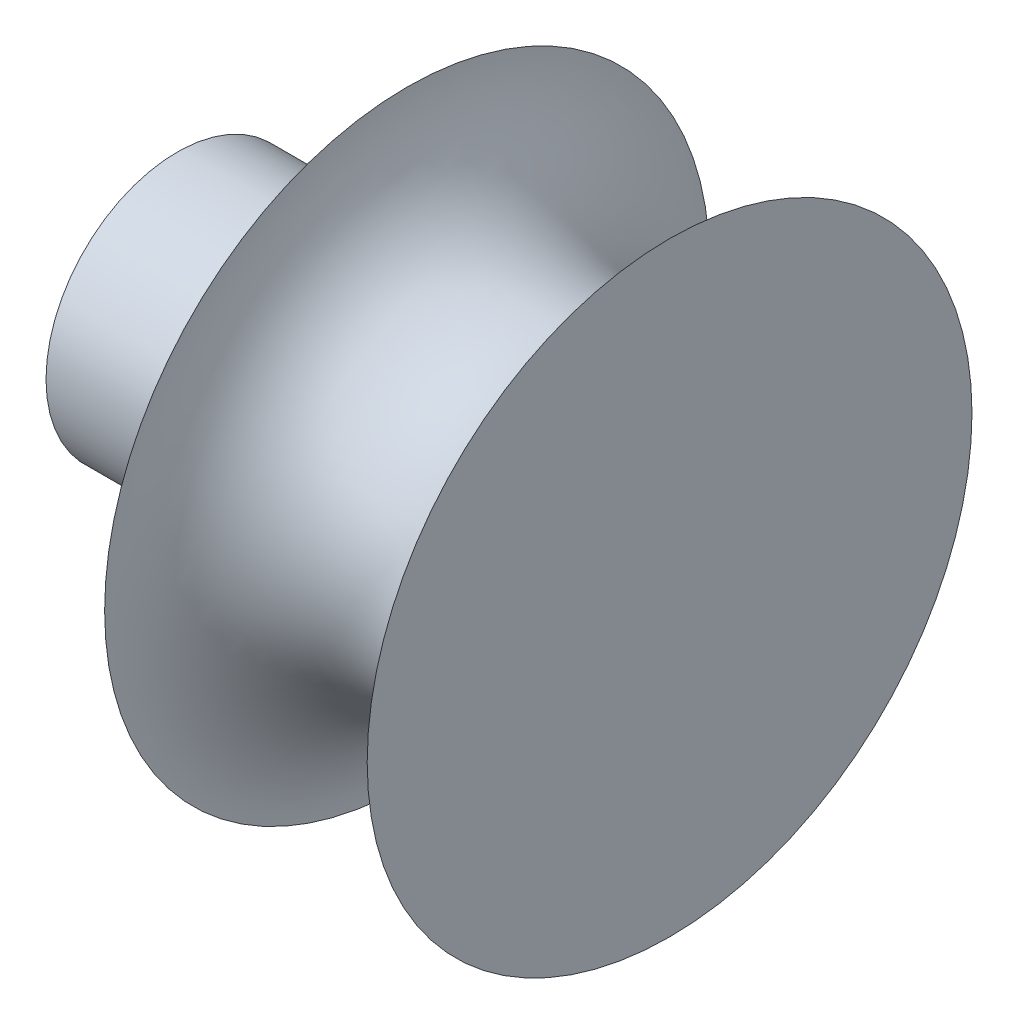
from build123d import *


with BuildPart() as part:
    # Sketch1 → Revolve1 (revolve)
    with BuildSketch(Plane.XY, mode=Mode.PRIVATE) as revolve1_sk:
        with BuildLine():
            Line((7, 9.214285714), (7, 4))
            Line((7, 4), (0, 4))
            Line((0, 4), (0, 0))
            Line((0, 0), (15, 0))
            Line((15, 0), (15, 9.214285714))
            ThreePointArc((15, 9.214285714), (11, 5.214285714), (7, 9.214285714))
        make_face()
    revolve(revolve1_sk.sketch.rotate(Axis((0, 0, 0), (1, 0, 0)), 90), axis=Axis((0, 0, 0), (1, 0, 0)))


solid = part.part
